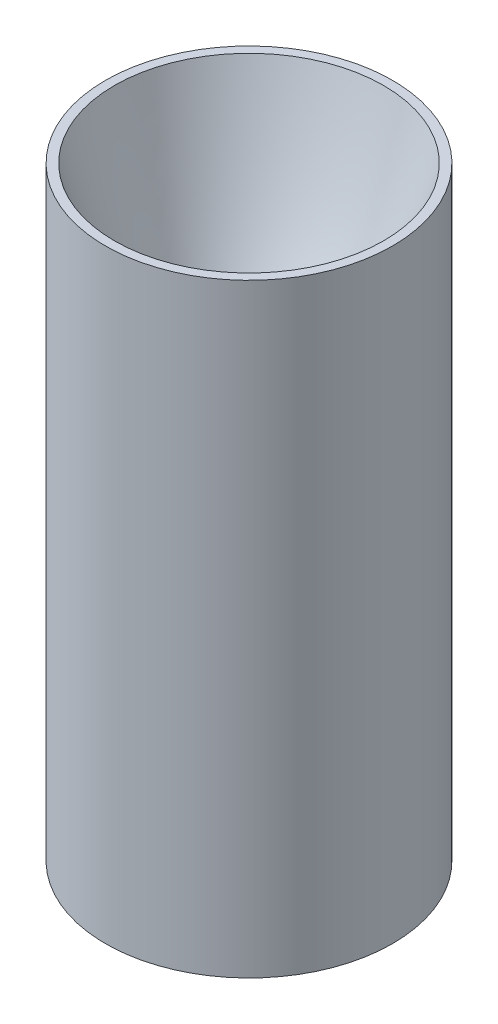
from build123d import *

# Parameters (mm, degrees)
CIRPATTERN1_COUNT = 8


with BuildPart() as part:
    # Sketch1 → Revolve2 (revolve)
    with BuildSketch(Plane.XY, mode=Mode.PRIVATE) as revolve2_sk:
        with BuildLine():
            Line((71.727523602, 109.927507641), (76.490023602, 109.927507641))
            Line((76.490023602, 109.927507641), (76.490023602, -212.127513222))
            Line((76.490023602, -212.127513222), (53.881527661, -212.127513222))
            Line((53.881527661, -212.127513222), (53.881527661, -59.727513222))
            add(Edge.make_bspline(
                [(53.881527661, -59.727513222), (53.88152643, -59.656983157), (53.880997287, -59.515406103), (53.878621437, -59.181564616), (53.872296838, -58.904795493), (53.862811351, -58.532567488), (53.850168453, -58.212837622), (53.830417626, -57.781594443), (53.800405285, -57.280959899), (53.756193121, -56.687998165), (53.677288452, -55.848480366), (53.577426861, -55.00816586), (53.456675786, -54.17243543), (53.286810822, -53.17242524), (53.092064187, -52.177442821), (52.86637512, -51.188539083), (52.610014224, -50.207489038), (52.32928934, -49.23307774), (52.024348739, -48.265969224), (51.633537831, -47.149135067), (51.139520361, -45.890408405), (50.598733753, -44.650968804), (50.012060928, -43.432701526), (49.380120231, -42.237093239), (48.704125229, -41.066154879), (47.98447552, -39.920972657), (47.223102138, -38.804076239), (46.51986906, -37.851451785), (45.893537937, -37.055672123), (45.352817681, -36.403381282), (44.915126948, -35.894247633), (44.51477619, -35.446992657), (44.181457503, -35.084631185), (43.873924624, -34.760340151), (43.674072407, -34.551549451), (43.444392073, -34.318516288), (43.343783151, -34.217162055), (43.293911001, -34.167289665)],
                knots=[0.082637729, 0.082637729, 0.082637729, 0.082637729, 0.082637729, 0.092574926, 0.102512123, 0.11244932, 0.122386517, 0.132323714, 0.142260911, 0.162135305, 0.182009699, 0.201884093, 0.24163288, 0.261507274, 0.281381668, 0.321130456, 0.360879243, 0.380753637, 0.400628031, 0.440376819, 0.480125606, 0.519874394, 0.559623181, 0.599371969, 0.639120757, 0.678869544, 0.718618332, 0.75836712, 0.798115907, 0.817990301, 0.837864695, 0.857739089, 0.877613483, 0.88755068, 0.897487877, 0.907425074, 0.91736227, 0.91736227, 0.91736227, 0.91736227, 0.91736227], degree=4))
            Line((43.293911001, -34.167289665), (34.686282803, -25.559661468))
            add(Edge.make_bspline(
                [(24.099067874, 0.000160672), (24.099069105, -0.070367974), (24.099598252, -0.213423516), (24.101973937, -0.543022243), (24.108298331, -0.823999723), (24.117783452, -1.194661398), (24.130425744, -1.513274385), (24.146225968, -1.86177893), (24.165181227, -2.193546198), (24.19281884, -2.617908727), (24.232287047, -3.121873274), (24.303299707, -3.879818002), (24.423126678, -4.886289715), (24.599486044, -6.056550088), (24.850885233, -7.385005743), (25.151795313, -8.703413843), (25.501770623, -10.009476538), (25.900360983, -11.301658927), (26.346945392, -12.577938667), (26.841003323, -13.836726817), (27.381673122, -15.076036463), (27.968479386, -16.294449129), (28.600139398, -17.489778131), (29.276532396, -18.661127095), (29.995445102, -19.805582737), (30.758021999, -20.923699417), (31.459167193, -21.874251104), (32.088736123, -22.673284825), (32.624128416, -23.320261484), (33.072255768, -23.839844364), (33.508450026, -24.329655594), (33.935826121, -24.788323739), (34.24555864, -25.11370766), (34.536859958, -25.409488397), (34.636412425, -25.509789283), (34.686282803, -25.559661468)],
                knots=[0.082637729, 0.082637729, 0.082637729, 0.082637729, 0.082637729, 0.092574926, 0.102512123, 0.11244932, 0.122386517, 0.132323714, 0.142260911, 0.152198108, 0.162135305, 0.182009699, 0.201884093, 0.24163288, 0.281381668, 0.321130456, 0.360879243, 0.400628031, 0.440376819, 0.480125606, 0.519874394, 0.559623181, 0.599371969, 0.639120757, 0.678869544, 0.718618332, 0.75836712, 0.798115907, 0.817990301, 0.837864695, 0.857739089, 0.877613483, 0.897487877, 0.907425074, 0.91736227, 0.91736227, 0.91736227, 0.91736227, 0.91736227], degree=4))
            add(Edge.make_bspline(
                [(24.099067874, 0.000160672), (24.0990685, 0.036053324), (24.099606331, 0.110274362), (24.102023723, 0.267801742), (24.108461568, 0.427224789), (24.120533599, 0.646924939), (24.141435087, 0.901594), (24.175184719, 1.202697945), (24.226499305, 1.54221117), (24.290543701, 1.881157449), (24.367141601, 2.216515092), (24.456323571, 2.549400093), (24.557741413, 2.878253317), (24.671619071, 3.203507713), (24.797196771, 3.523787829), (24.935285977, 3.839827405), (25.084070301, 4.149442857), (25.246012222, 4.454943795), (25.416488505, 4.751462248), (25.602514721, 5.045864533), (25.79178827, 5.325679608), (26.004405474, 5.610888215), (26.178876374, 5.83307432), (26.366345756, 6.050112309), (26.504555248, 6.208802318), (26.67044207, 6.382282451), (26.744520261, 6.458639514), (26.795279203, 6.509400323)],
                knots=[0.082568816, 0.082568816, 0.082568816, 0.082568816, 0.082568816, 0.102426634, 0.122284453, 0.142142271, 0.162000089, 0.201715725, 0.241431362, 0.281146998, 0.320862634, 0.360578271, 0.400293907, 0.440009544, 0.47972518, 0.519440816, 0.559156453, 0.598872089, 0.638587725, 0.678303362, 0.718018998, 0.757734635, 0.797450271, 0.837165907, 0.857023726, 0.876881544, 0.91659718, 0.91659718, 0.91659718, 0.91659718, 0.91659718], degree=4))
            add(Edge.make_bspline(
                [(26.795279203, 6.509400323), (49.261401403, 34.636114842), (71.727523602, 109.927507641)],
                knots=[0, 0, 0, 1, 1, 1], degree=2))
        make_face()
    revolve(revolve2_sk.sketch.rotate(Axis((-0.005532126, 165.815985114, 0), (0, -1, 0)), 180), axis=Axis((-0.005532126, 165.815985114, 0), (0, -1, 0)))

    # Sketch4 → 3/8-24 Tapped Hole1 (revolve, cut)
    with BuildSketch(Plane(origin=(65.2, -212.127513222, 0), x_dir=(0, 0, -1), z_dir=(1, 0, 0))):
        Polygon((0, 0), (0, 27.533468714), (4.2164, 25), (4.2164, 0), align=None)
    f_3_8_24_tapped_hole1 = revolve(axis=Axis((65.2, -218.477513222, 0), (0, 1, 0)), mode=Mode.SUBTRACT)

    # CirPattern1: 3/8-24 Tapped Hole1 ×8 about axis
    cirpattern1_axis = Axis((0, -228.487022387, 0), (-1.634718801334702e-05, 0.9999999998663848, 0))
    for i in range(1, CIRPATTERN1_COUNT):
        add(f_3_8_24_tapped_hole1.rotate(cirpattern1_axis, i * 360 / CIRPATTERN1_COUNT), mode=Mode.SUBTRACT)


solid = part.part
